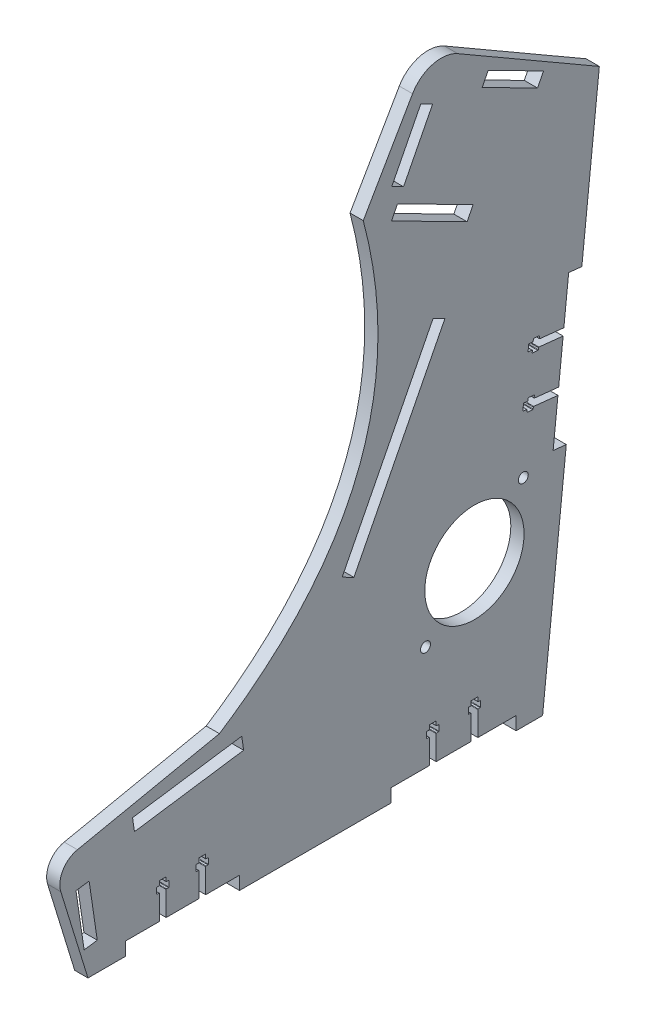
from build123d import *

# Parameters (mm, degrees)
BOSS_EXTRUDE3_DEPTH  = 12
CUT_EXTRUDE1_DEPTH   = 749.498850509
BOSS_EXTRUDE10_DEPTH = 12
BOSS_EXTRUDE11_DEPTH = 12
BOSS_EXTRUDE12_DEPTH = 12
BOSS_EXTRUDE13_DEPTH = 12
SKETCH13_W           = 113.33
SKETCH13_H           = 12
SKETCH13_W_2         = 103.33
CUT_EXTRUDE2_DEPTH   = 12
CUT_EXTRUDE4_DEPTH   = 12
SCALE1_SCALE         = 0.5
M4_CLEARANCE_SLOT1_D = 4.5
CUT_EXTRUDE5_REACH   = 565.387
SKETCH18_R           = 22.5
SKETCH22_W           = 6
SKETCH22_H           = 3.1
CUT_EXTRUDE6_DEPTH   = 16
SKETCH23_W           = 6
SKETCH23_H           = 3.1
CUT_EXTRUDE7_DEPTH   = 16
CUT_EXTRUDE8_START   = -6
SKETCH24_W           = 5.5
SKETCH24_H           = 2.8
CUT_EXTRUDE8_DEPTH   = 6
FILLET1_R            = 0.2


with BuildPart() as part:
    # Sketch6 → Boss-Extrude3 (new body)
    with BuildSketch(Plane(origin=(0, 0, 0), x_dir=(0, 0, -1), z_dir=(1, 0, 0))):
        with BuildLine():
            Line((443.008381003, 0), (494.423974448, 483.65151844))
            Line((494.423974448, 483.65151844), (366.149980976, 557.801464033))
            ThreePointArc((366.149980976, 557.801464033), (343.387005566, 560.81057426), (325.163389047, 546.842482234))
            Line((325.163389047, 546.842482234), (280.507038844, 469.590255969))
            add(Edge.make_bspline(
                [(280.507038844, 469.590255969), (337.547414774, 253.666235615), (150.134747453, 132.20315818)],
                knots=[0, 0, 0, 1, 1, 1], degree=2))
            Line((150.134747453, 132.20315818), (21.492939107, 105.435528363))
            ThreePointArc((21.492939107, 105.435528363), (8.348852088, 96.029741149), (6.449920425, 79.978887114))
            Line((6.449920425, 79.978887114), (31.032803143, 0))
            Line((31.032803143, 0), (443.008381003, 0))
        make_face()
    extrude(amount=BOSS_EXTRUDE3_DEPTH)

    # Sketch7 → Cut-Extrude1 (cut, through all)
    with BuildSketch(Plane(origin=(12, 0, 0), x_dir=(0, 0, -1), z_dir=(1, 0, 0))):
        Polygon((27.561091859, 23.747572949), (16.762492935, 97.613310816), (225.041152329, 128.062038089), (374.58155558, 421.677438165), (295.408487846, 462.000842429), (343.523446296, 556.472252614), (443.849062543, 505.375705546), (438.403030356, 494.682682895), (348.77043676, 540.333197776), (311.547542684, 467.247832894), (390.720610418, 426.92442863), (232.917689381, 117.085971691), (30.372135049, 87.475379986), (39.434878331, 25.483428591), align=None)
    extrude(amount=-CUT_EXTRUDE1_DEPTH, mode=Mode.SUBTRACT)

    # Sketch9 → Boss-Extrude10 (add)
    with BuildSketch(Plane(origin=(12, 0, 0), x_dir=(0, 0, -1), z_dir=(1, 0, 0))):
        Polygon((16.762492935, 97.613310816), (20.234204219, 73.865737871), (32.107990691, 75.601593513), (28.636279407, 99.349166458), align=None)
    extrude(amount=-BOSS_EXTRUDE10_DEPTH)

    # Sketch10 → Boss-Extrude11 (add)
    with BuildSketch(Plane(origin=(12, 0, 0), x_dir=(0, 0, -1), z_dir=(1, 0, 0))):
        Polygon((28.636279407, 99.349166458), (71.431384818, 105.605479501), (73.16724046, 93.731693028), (30.372135049, 87.475379986), align=None)
        Polygon((225.041152329, 128.062038089), (170.372260446, 120.069869405), (172.108116088, 108.196082932), (232.917689381, 117.085971691), align=None)
    extrude(amount=-BOSS_EXTRUDE11_DEPTH)

    # Sketch11 → Boss-Extrude12 (add)
    with BuildSketch(Plane(origin=(12, 0, 0), x_dir=(0, 0, -1), z_dir=(1, 0, 0))):
        Polygon((390.720610418, 426.92442863), (354.413729174, 355.637610954), (343.720706523, 361.08364314), (380.027587766, 432.370460816), align=None)
        Polygon((272.042492354, 193.905643351), (232.917689381, 117.085971691), (225.041152329, 128.062038089), (261.349469702, 199.351675538), align=None)
    extrude(amount=-BOSS_EXTRUDE12_DEPTH)

    # Sketch12 → Boss-Extrude13 (add)
    with BuildSketch(Plane(origin=(12, 0, 0), x_dir=(0, 0, -1), z_dir=(1, 0, 0))):
        Polygon((295.408487846, 462.000842429), (306.300552219, 483.386887732), (316.993574871, 477.940855546), (306.101510498, 456.554810243), align=None)
        Polygon((343.523446296, 556.472252614), (332.631381923, 535.086207311), (343.324404574, 529.640175125), (348.77043676, 540.333197776), (388.245512049, 520.228262288), (393.691544235, 530.921284939), align=None)
    extrude(amount=-BOSS_EXTRUDE13_DEPTH)

    # Sketch13 → Cut-Extrude2 (cut)
    with BuildSketch(Plane(origin=(12, 0, 0), x_dir=(0, 0, -1), z_dir=(1, 0, 0))):
        with Locations((362.343381003, 6)):
            Rectangle(SKETCH13_W, SKETCH13_H)
        with Locations((116.686714336, 6)):
            Rectangle(SKETCH13_W_2, SKETCH13_H)
    extrude(amount=-CUT_EXTRUDE2_DEPTH, mode=Mode.SUBTRACT)

    # Sketch15 → Cut-Extrude4 (cut)
    with BuildSketch(Plane(origin=(12, 0, 0), x_dir=(0, 0, -1), z_dir=(1, 0, 0))):
        Polygon((464.472396543, 201.905745164), (452.539634381, 203.174282581), (466.634494571, 335.760528829), (478.567256734, 334.491991411), align=None)
    extrude(amount=-CUT_EXTRUDE4_DEPTH, mode=Mode.SUBTRACT)


with BuildPart() as part_1:
    # Scale1: scaled about (6, 218.672965902, -318.160340779)
    add(part.part.scale(SCALE1_SCALE).moved(Location((3, 109.336482951, -159.08017039))))

    # M4 Clearance Slot1 (through all)
    with Locations(Plane.ZY.offset(-3)):
        with Locations((-371.832709578, 207.025100455), (-327.532709578, 162.725100455)):
            Hole(M4_CLEARANCE_SLOT1_D / 2)

    # Sketch18 → Cut-Extrude5 (cut, up to next)
    with BuildSketch(Plane(origin=(9, 0, 0), x_dir=(0, 0, -1), z_dir=(1, 0, 0)), mode=Mode.PRIVATE) as cut_extrude5_sk1:
        with Locations((349.682709578, 184.875100455)):
            Circle(SKETCH18_R)
    cut_extrude5_tool1 = extrude(cut_extrude5_sk1.sketch, amount=-CUT_EXTRUDE5_REACH, mode=Mode.PRIVATE) & part_1.part
    add(cut_extrude5_tool1.solids().sort_by_distance((9, 184.8751, -349.68271))[0], mode=Mode.SUBTRACT)

    # Sketch22 → Cut-Extrude6 (cut)
    with BuildSketch(Plane(origin=(0, -38.150606728, -358.871650347), x_dir=(-1, 0, 0), z_dir=(0, -0.10571145143146571, -0.9943968468555464))):
        with Locations((-6, 294.924285011)):
            Rectangle(SKETCH22_W, SKETCH22_H)
        with Locations((-6, 272.697618344)):
            Rectangle(SKETCH22_W, SKETCH22_H)
    extrude(amount=-CUT_EXTRUDE6_DEPTH, mode=Mode.SUBTRACT)

    # Sketch23 → Cut-Extrude7 (cut)
    with BuildSketch(Plane.XZ.offset(-115.336405871)):
        with Locations((6, -349.696042911)):
            Rectangle(SKETCH23_W, SKETCH23_H)
        with Locations((6, -330.806042911)):
            Rectangle(SKETCH23_W, SKETCH23_H)
        with Locations((6, -226.369376245)):
            Rectangle(SKETCH23_W, SKETCH23_H)
        with Locations((6, -208.479376245)):
            Rectangle(SKETCH23_W, SKETCH23_H)
    extrude(amount=-CUT_EXTRUDE7_DEPTH, mode=Mode.SUBTRACT)

    # Sketch24 → Cut-Extrude8 (cut)
    with BuildSketch(Plane(origin=(9, 0, 0), x_dir=(0, 0, -1), z_dir=(1, 0, 0)).offset(CUT_EXTRUDE8_START)):
        with Locations((349.696042911, 127.936405871)):
            Rectangle(SKETCH24_W, SKETCH24_H)
        with Locations((330.806042911, 127.936405871)):
            Rectangle(SKETCH24_W, SKETCH24_H)
        with Locations((226.369376245, 127.936405871)):
            Rectangle(SKETCH24_W, SKETCH24_H)
        with Locations((208.479376245, 127.936405871)):
            Rectangle(SKETCH24_W, SKETCH24_H)
        Polygon((373.491934609, 231.814133932), (376.276245781, 231.518141868), (376.857658763, 236.987324526), (374.073347592, 237.28331659), align=None)
        Polygon((376.422960786, 259.385443839), (379.207271957, 259.089451775), (378.625858974, 253.620269118), (375.841547803, 253.916261182), align=None)
    extrude(amount=CUT_EXTRUDE8_DEPTH, mode=Mode.SUBTRACT)

    # Fillet1
    fillet1_edges = [part_1.edges().sort_by_distance(p)[0] for p in [
        (6, 255.271240458, -373.974322279),
        (6, 258.353870684, -374.302027778),
        (6, 233.169113209, -371.624709085),
        (6, 236.251743434, -371.952414584),
        (6, 131.336405871, -351.246042911),
        (6, 131.336405871, -348.146042911),
        (6, 131.336405871, -332.356042911),
        (6, 131.336405871, -329.256042911),
        (6, 131.336405871, -227.919376245),
        (6, 131.336405871, -224.819376245),
        (6, 131.336405871, -210.029376245),
        (6, 131.336405871, -206.929376245),
        (6, 129.336405871, -346.946042911),
        (6, 126.536405871, -346.946042911),
        (6, 126.536405871, -348.146042911),
        (6, 129.336405871, -348.146042911),
        (6, 129.336405871, -352.446042911),
        (6, 126.536405871, -352.446042911),
        (6, 126.536405871, -351.246042911),
        (6, 129.336405871, -351.246042911),
        (6, 129.336405871, -333.556042911),
        (6, 126.536405871, -333.556042911),
        (6, 126.536405871, -332.356042911),
        (6, 129.336405871, -332.356042911),
        (6, 129.336405871, -229.119376245),
        (6, 126.536405871, -229.119376245),
        (6, 126.536405871, -227.919376245),
        (6, 129.336405871, -227.919376245),
        (6, 129.336405871, -211.229376245),
        (6, 126.536405871, -211.229376245),
        (6, 126.536405871, -210.029376245),
        (6, 129.336405871, -210.029376245),
        (6, 254.763825491, -378.747427143),
        (6, 255.059817555, -375.963115972),
        (6, 253.620269118, -378.625858974),
        (6, 253.916261182, -375.841547803),
        (6, 231.518141868, -376.276245781),
        (6, 231.814133932, -373.491934609),
        (6, 232.661698242, -376.39781395),
        (6, 232.957690306, -373.613502778),
        (6, 129.336405871, -328.056042911),
        (6, 126.536405871, -328.056042911),
        (6, 126.536405871, -329.256042911),
        (6, 129.336405871, -329.256042911),
        (6, 129.336405871, -223.619376245),
        (6, 126.536405871, -223.619376245),
        (6, 126.536405871, -224.819376245),
        (6, 129.336405871, -224.819376245),
        (6, 129.336405871, -205.729376245),
        (6, 126.536405871, -205.729376245),
        (6, 126.536405871, -206.929376245),
        (6, 129.336405871, -206.929376245),
        (6, 257.846455717, -379.075132643),
        (6, 258.142447781, -376.290821472),
        (6, 259.385443839, -376.422960786),
        (6, 259.089451775, -379.207271957),
        (6, 237.28331659, -374.073347592),
        (6, 236.987324526, -376.857658763),
        (6, 235.744328467, -376.725519449),
        (6, 236.040320531, -373.941208278),
    ]]
    fillet(fillet1_edges, radius=FILLET1_R)


solid = part_1.part
